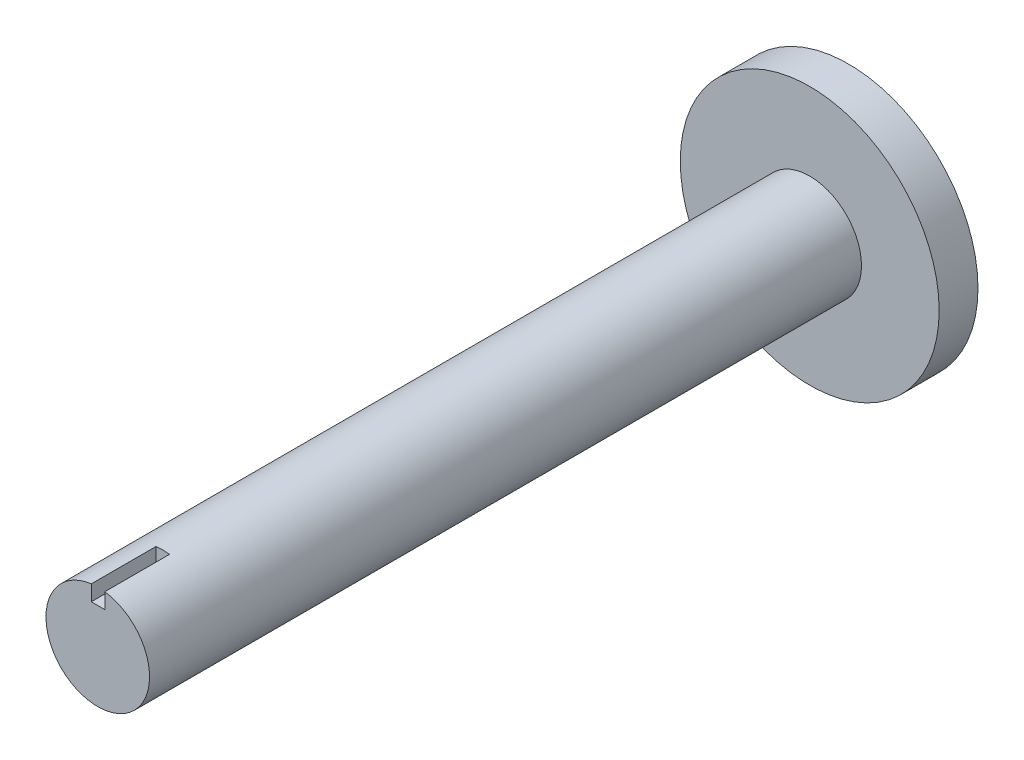
from build123d import *

# Parameters (mm, degrees)
SKETCH1_R           = 10
BOSS_EXTRUDE1_DEPTH = 3
SKETCH2_R           = 4
BOSS_EXTRUDE2_DEPTH = 55
CUT_EXTRUDE1_DEPTH  = 10


with BuildPart() as part:
    # Sketch1 → Boss-Extrude1 (new body)
    with BuildSketch(Plane.XY):
        Circle(SKETCH1_R)
    extrude(amount=BOSS_EXTRUDE1_DEPTH)

    # Sketch2 → Boss-Extrude2 (add)
    with BuildSketch(Plane.XY.offset(3)):
        Circle(SKETCH2_R)
    extrude(amount=BOSS_EXTRUDE2_DEPTH)

    # Sketch3 → Cut-Extrude1 (cut)
    with BuildSketch(Plane.XY.offset(53)):
        with BuildLine():
            Line((-0.5, 3.968626967), (-0.5, 2.768626967))
            Line((-0.5, 2.768626967), (0.543300129, 2.768626967))
            Line((0.543300129, 2.768626967), (0.543300129, 3.962931361))
            ThreePointArc((0.543300129, 3.962931361), (0.021836558, 3.999940395), (-0.5, 3.968626967))
        make_face()
    extrude(amount=CUT_EXTRUDE1_DEPTH, mode=Mode.SUBTRACT)


solid = part.part
